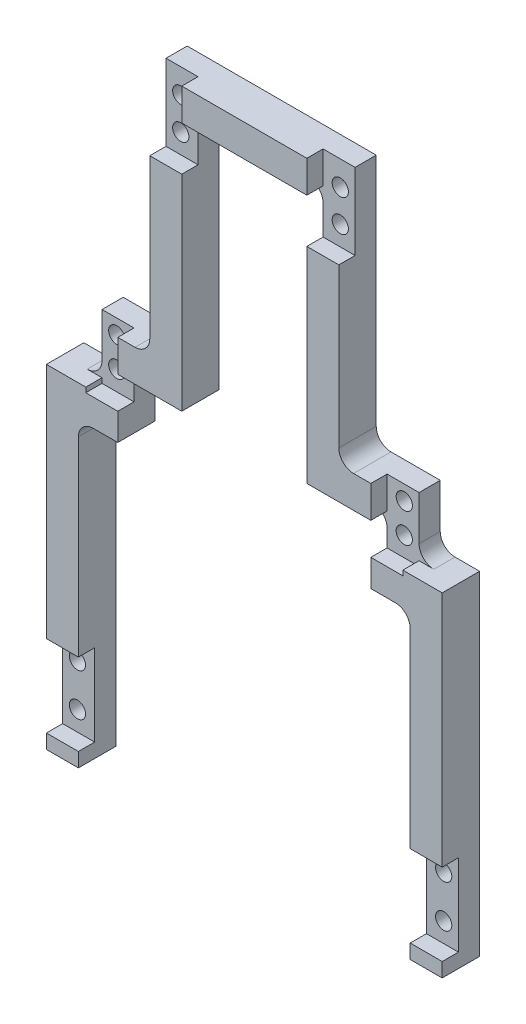
from build123d import *

# Parameters (mm, degrees)
SKETCH1_R           = 1.65
BOSS_EXTRUDE1_DEPTH = 7.6
CUT_EXTRUDE1_REACH  = 89.547
SKETCH3_W           = 6.5
SKETCH3_H           = 15.5
SKETCH3_H_2         = 14
SKETCH3_H_3         = 16.6
CUT_EXTRUDE2_DEPTH  = 3.3
FILLET1_R           = 3


with BuildPart() as part:
    # Sketch1 → Boss-Extrude1 (new body)
    with BuildSketch(Plane.XY):
        Polygon((19.2, 59.55), (19.2, 8.85), (32.2, 8.85), (32.2, -3.15), (40.2, -3.15), (40.2, -77.4), (-40.2, -77.4), (-40.2, -3.15), (-32.2, -3.15), (-32.2, 8.85), (-19.2, 8.85), (-19.2, 59.55), align=None)
        with Locations((29.2, 5.85)):
            Circle(SKETCH1_R, mode=Mode.SUBTRACT)
        with Locations((29.2, -0.15)):
            Circle(SKETCH1_R, mode=Mode.SUBTRACT)
        with Locations((37.2, -55.4)):
            Circle(SKETCH1_R, mode=Mode.SUBTRACT)
        with Locations((37.2, -64)):
            Circle(SKETCH1_R, mode=Mode.SUBTRACT)
        with Locations((16.2, 48.05)):
            Circle(SKETCH1_R, mode=Mode.SUBTRACT)
        with Locations((16.2, 54.55)):
            Circle(SKETCH1_R, mode=Mode.SUBTRACT)
        with Locations(Location((-16.2, 54.55, 0), (0, 0, 180))):
            Circle(SKETCH1_R, mode=Mode.SUBTRACT)
        with Locations(Location((-16.2, 48.05, 0), (0, 0, 180))):
            Circle(SKETCH1_R, mode=Mode.SUBTRACT)
        with Locations(Location((-37.2, -64, 0), (0, 0, 180))):
            Circle(SKETCH1_R, mode=Mode.SUBTRACT)
        with Locations(Location((-37.2, -55.4, 0), (0, 0, 180))):
            Circle(SKETCH1_R, mode=Mode.SUBTRACT)
        with Locations(Location((-29.2, -0.15, 0), (0, 0, 180))):
            Circle(SKETCH1_R, mode=Mode.SUBTRACT)
        with Locations(Location((-29.2, 5.85, 0), (0, 0, 180))):
            Circle(SKETCH1_R, mode=Mode.SUBTRACT)
    extrude(amount=-BOSS_EXTRUDE1_DEPTH)

    # Sketch2 → Cut-Extrude1 (cut, up to next)
    with BuildSketch(Plane(origin=(0, 0, -7.6), x_dir=(-1, 0, 0), z_dir=(0, 0, -1)), mode=Mode.PRIVATE) as cut_extrude1_sk1:
        Polygon((-12.7, 2.35), (-12.7, 53.05), (12.7, 53.05), (12.7, 2.35), (25.7, 2.35), (25.7, -9.65), (33.7, -9.65), (33.7, -70.9), (40.2, -70.9), (40.2, -77.4), (-40.2, -77.4), (-40.2, -70.9), (-33.7, -70.9), (-33.7, -9.65), (-25.7, -9.65), (-25.7, 2.35), align=None)
    cut_extrude1_tool1 = extrude(cut_extrude1_sk1.sketch, amount=-CUT_EXTRUDE1_REACH, mode=Mode.PRIVATE) & part.part
    add(cut_extrude1_tool1.solids().sort_by_distance((0, -26.176143, -7.6))[0], mode=Mode.SUBTRACT)

    # Sketch3 → Cut-Extrude2 (cut)
    with BuildSketch(Plane(origin=(0, 0, 0), x_dir=(-1, 0, 0), z_dir=(0, 0, -1))):
        with Locations((15.95, 51.8)):
            Rectangle(SKETCH3_W, SKETCH3_H)
        with Locations((28.95, 2.85)):
            Rectangle(SKETCH3_W, SKETCH3_H_2)
        with Locations((36.95, -59.7)):
            Rectangle(SKETCH3_W, SKETCH3_H_3)
    cut_extrude2 = extrude(amount=CUT_EXTRUDE2_DEPTH, mode=Mode.SUBTRACT)

    # Mirror1: Cut-Extrude2 across plane
    add(cut_extrude2.mirror(Plane(origin=(0, 0, 0), x_dir=(0, 0, 1), z_dir=(1, 0, 0))), mode=Mode.SUBTRACT)

    # Fillet1
    fillet1_edges = [part.edges().sort_by_distance(p)[0] for p in [
        (-25.7, 2.35, -5.45),
        (-12.7, 53.05, -5.45),
        (19.2, 8.85, -3.8),
        (32.2, -3.15, -5.45),
        (25.7, 2.35, -5.45),
        (12.7, 53.05, -5.45),
        (-32.2, -3.15, -5.45),
        (-19.2, 8.85, -3.8),
        (-33.7, -9.65, -3.8),
        (33.7, -9.65, -3.8),
    ]]
    fillet(fillet1_edges, radius=FILLET1_R)


solid = part.part
